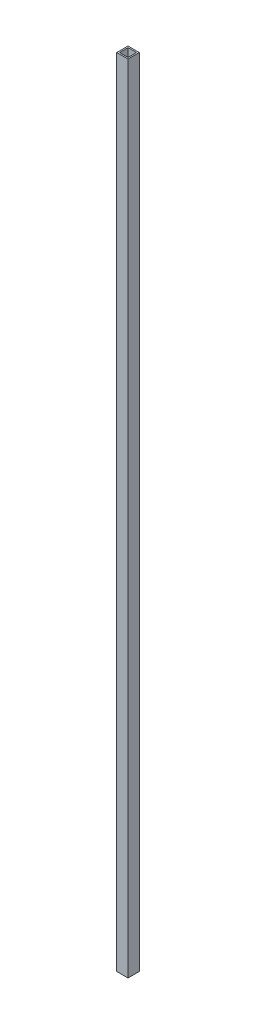
from build123d import *

# Parameters (mm, degrees)
SCHIZZO1_W                   = 40
SCHIZZO1_H                   = 40
SCHIZZO1_W_2                 = 30
SCHIZZO1_H_2                 = 30
ESTRUSIONE_ESTRUSIONE1_DEPTH = 1408.5


with BuildPart() as part:
    # Schizzo1 → Estrusione-Estrusione1 (new, symmetric)
    with BuildSketch(Plane(origin=(0, 0, 0), x_dir=(1, 0, 0), z_dir=(0, 1, 0))):
        Rectangle(SCHIZZO1_W, SCHIZZO1_H)
        Rectangle(SCHIZZO1_W_2, SCHIZZO1_H_2, mode=Mode.SUBTRACT)
    extrude(amount=ESTRUSIONE_ESTRUSIONE1_DEPTH, both=True)


solid = part.part
